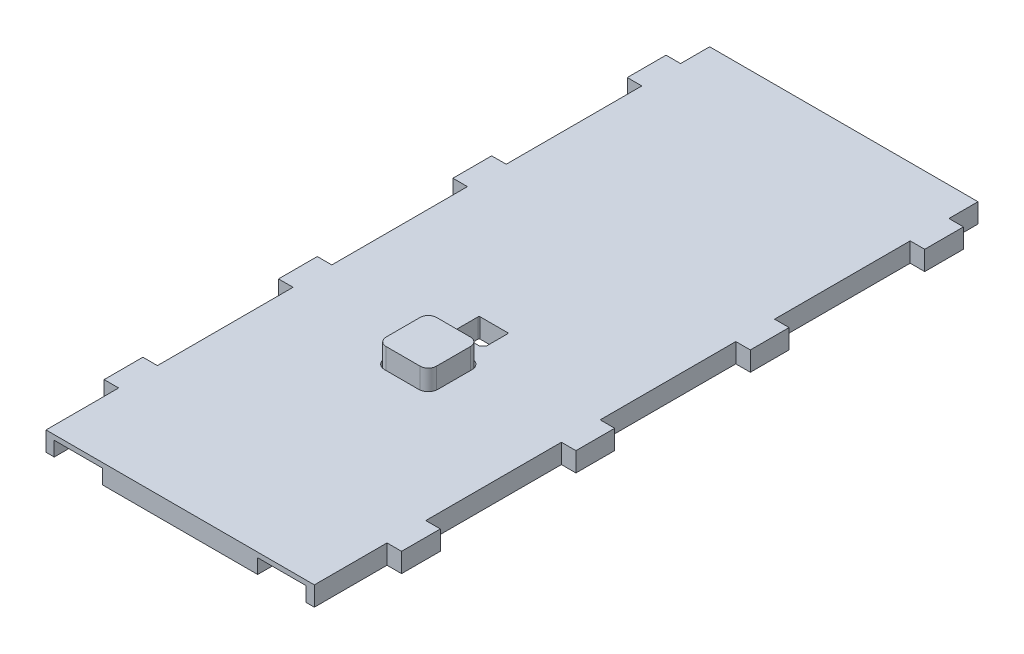
from build123d import *

# Parameters (mm, degrees)
SKETCH_1_W          = 27.7
SKETCH_1_H          = 2
EXTRUDE_1_DEPTH     = 70.5
SKETCH_16_W         = 5
SKETCH_16_H         = 1.5
CUT_EXTRUDE_6_DEPTH = 5
SKETCH_4_W          = 5.5
SKETCH_4_H          = 5.5
CUT_EXTRUDE_2_DEPTH = 72.875395651
FILLET_1_R          = 1
EXTRUDE_3_DEPTH     = 4
SKETCH_6_R          = 0.9
EXTRUDE_4_DEPTH     = 2
SKETCH_7_R          = 0.75
EXTRUDE_5_DEPTH     = 4.5
EXTRUDE_START       = 2
EXTRUDE_6_DEPTH     = 3
CUT_EXTRUDE_7_DEPTH = 2
SKETCH_18_W         = 27.7
SKETCH_18_H         = 2
CUT_EXTRUDE_8_DEPTH = 73.187758774
SKETCH_19_W         = 4
SKETCH_19_H         = 2
EXTRUDE_7_DEPTH     = 1.5
SKETCH_20_W         = 4
SKETCH_20_H         = 2
EXTRUDE_9_DEPTH     = 1.5
SKETCH_21_W         = 5
SKETCH_21_H         = 1.5
CUT_EXTRUDE_9_DEPTH = 5


with BuildPart() as part:
    # 草图1 → 凸台-拉伸1 (new body)
    with BuildSketch(Plane.XY):
        with Locations((0, 1)):
            Rectangle(SKETCH_1_W, SKETCH_1_H)
    extrude(amount=EXTRUDE_1_DEPTH)

    # 草图16 → 切除-拉伸6 (cut)
    with BuildSketch(Plane.XY.offset(70.5)):
        with Locations((-10.5, 0.75)):
            Rectangle(SKETCH_16_W, SKETCH_16_H)
        with Locations((10.5, 0.75)):
            Rectangle(SKETCH_16_W, SKETCH_16_H)
    extrude(amount=-CUT_EXTRUDE_6_DEPTH, mode=Mode.SUBTRACT)

    # 草图4 → 切除-拉伸2 (cut, through all)
    with BuildSketch(Plane(origin=(0, 2, 0), x_dir=(1, 0, 0), z_dir=(0, 1, 0))):
        with Locations((-0.000254001, -44.890957582)):
            Rectangle(SKETCH_4_W, SKETCH_4_H)
    extrude(amount=-CUT_EXTRUDE_2_DEPTH, mode=Mode.SUBTRACT)

    # 圆角1
    fillet_1_edges = [part.edges().sort_by_distance(p)[0] for p in [
        (2.749745999, 1, 42.140957582),
        (2.749745999, 1, 47.640957582),
        (-2.750254001, 1, 47.640957582),
        (-2.750254001, 1, 42.140957582),
    ]]
    fillet(fillet_1_edges, radius=FILLET_1_R)

    # 草图7 → 凸台-拉伸5 (add)
    with BuildSketch(Plane.XZ):
        with Locations(Location((4.199745999, 44.890957582, 0), (0, 0, 180))):
            Circle(SKETCH_7_R)
        with Locations(Location((-4.200254001, 44.890957582, 0), (0, 0, 180))):
            Circle(SKETCH_7_R)
    extrude(amount=EXTRUDE_5_DEPTH)

    # 草图17 → 切除-拉伸7 (cut)
    with BuildSketch(Plane(origin=(0, 2, 0), x_dir=(1, 0, 0), z_dir=(0, 1, 0))):
        with BuildLine():
            Line((1.381293223, -40.281381402), (1.381293223, -38.081000872))
            add(Edge.make_bspline(
                [(1.381293223, -38.081000872), (1.381293223, -37.981381402), (1.281673753, -37.981381402)],
                knots=[5.501585242, 5.501585242, 5.501585242, 7.064785372, 7.064785372, 7.064785372], degree=2, weights=[1, 0.709787336, 1]))
            Line((1.281673753, -37.981381402), (-1.561607713, -37.981381402))
            add(Edge.make_bspline(
                [(-1.561607713, -37.981381402), (-1.661227183, -37.981381402), (-1.661227183, -38.081000872)],
                knots=[5.501585242, 5.501585242, 5.501585242, 7.064785372, 7.064785372, 7.064785372], degree=2, weights=[1, 0.709787336, 1]))
            Line((-1.661227183, -38.081000872), (-1.661227183, -40.524282338))
            add(Edge.make_bspline(
                [(-1.661227183, -40.524282338), (-1.661227183, -40.623901808), (-1.561607713, -40.623901808)],
                knots=[5.501585242, 5.501585242, 5.501585242, 7.064785372, 7.064785372, 7.064785372], degree=2, weights=[1, 0.709787336, 1]))
            Line((-1.561607713, -40.623901808), (1.038772817, -40.623901808))
            Line((1.038772817, -40.623901808), (1.381293223, -40.281381402))
        make_face()
    extrude(amount=-CUT_EXTRUDE_7_DEPTH, mode=Mode.SUBTRACT)

    # 草图18 → 切除-拉伸8 (cut, through all)
    with BuildSketch(Plane(origin=(0, 2, 0), x_dir=(1, 0, 0), z_dir=(0, 1, 0))):
        with Locations((0, -1)):
            Rectangle(SKETCH_18_W, SKETCH_18_H)
    extrude(amount=-CUT_EXTRUDE_8_DEPTH, mode=Mode.SUBTRACT)

    # 草图19 → 凸台-拉伸7 (add)
    with BuildSketch(Plane.ZY.offset(13.85)):
        with Locations((7, 1)):
            Rectangle(SKETCH_19_W, SKETCH_19_H)
        with Locations((43, 1)):
            Rectangle(SKETCH_19_W, SKETCH_19_H)
        with Locations((25, 1)):
            Rectangle(SKETCH_19_W, SKETCH_19_H)
        with Locations((61, 1)):
            Rectangle(SKETCH_19_W, SKETCH_19_H)
    extrude(amount=EXTRUDE_7_DEPTH)

    # 草图20 → 凸台-拉伸9 (add)
    with BuildSketch(Plane(origin=(13.85, 0, 0), x_dir=(0, 0, -1), z_dir=(1, 0, 0))):
        with Locations((-61, 1)):
            Rectangle(SKETCH_20_W, SKETCH_20_H)
        with Locations((-43, 1)):
            Rectangle(SKETCH_20_W, SKETCH_20_H)
        with Locations((-25, 1)):
            Rectangle(SKETCH_20_W, SKETCH_20_H)
        with Locations((-7, 1)):
            Rectangle(SKETCH_20_W, SKETCH_20_H)
    extrude(amount=EXTRUDE_9_DEPTH)

    # 草图21 → 切除-拉伸9 (cut)
    with BuildSketch(Plane(origin=(0, 0, 2), x_dir=(-1, 0, 0), z_dir=(0, 0, -1))):
        with Locations((-10.5, 0.75)):
            Rectangle(SKETCH_21_W, SKETCH_21_H)
        with Locations((10.5, 0.75)):
            Rectangle(SKETCH_21_W, SKETCH_21_H)
    extrude(amount=-CUT_EXTRUDE_9_DEPTH, mode=Mode.SUBTRACT)


with BuildPart() as body_2:
    # 草图5 → 凸台-拉伸3 (new body)
    with BuildSketch(Plane.XZ):
        with BuildLine():
            Line((-2.600254001, 46.640957582), (-2.600254001, 43.140957582))
            ThreePointArc((-2.600254001, 43.140957582), (-2.351294765, 42.539916818), (-1.750254001, 42.290957582))
            Line((-1.750254001, 42.290957582), (1.749745999, 42.290957582))
            ThreePointArc((1.749745999, 42.290957582), (2.350786764, 42.539916818), (2.599745999, 43.140957582))
            Line((2.599745999, 43.140957582), (2.599745999, 46.640957582))
            ThreePointArc((2.599745999, 46.640957582), (2.350786764, 47.241998346), (1.749745999, 47.490957582))
            Line((1.749745999, 47.490957582), (-1.750254001, 47.490957582))
            ThreePointArc((-1.750254001, 47.490957582), (-2.351294765, 47.241998346), (-2.600254001, 46.640957582))
        make_face()
    extrude(amount=-EXTRUDE_3_DEPTH)

    # 草图6 → 凸台-拉伸4 (add)
    # profile 1 of 3: a face of its own
    with BuildSketch(Plane.XZ):
        with BuildLine():
            ThreePointArc((-2.600254001, 46.640957582), (-2.459343486, 47.109670821), (-2.08333141, 47.422980241))
            Line((-2.08333141, 47.422980241), (-4.788037664, 46.270997568))
            ThreePointArc((-4.788037664, 46.270997568), (-5.700254001, 44.890957582), (-4.788037664, 43.510917595))
            Line((-4.788037664, 43.510917595), (-2.08333141, 42.358934923))
            ThreePointArc((-2.08333141, 42.358934923), (-2.459343486, 42.672244342), (-2.600254001, 43.140957582))
            Line((-2.600254001, 43.140957582), (-2.600254001, 46.640957582))
        make_face()
        with Locations(Location((-4.200254001, 44.890957582, 0), (0, 0, 270))):
            Circle(SKETCH_6_R, mode=Mode.SUBTRACT)
    # profile 2 of 3: a face of its own
    with BuildSketch(Plane.XZ):
        with BuildLine():
            Line((1.749745999, 47.490957582), (-1.750254001, 47.490957582))
            ThreePointArc((-1.750254001, 47.490957582), (-2.351294765, 47.241998346), (-2.600254001, 46.640957582))
            Line((-2.600254001, 46.640957582), (-2.600254001, 43.140957582))
            ThreePointArc((-2.600254001, 43.140957582), (-2.351294765, 42.539916818), (-1.750254001, 42.290957582))
            Line((-1.750254001, 42.290957582), (1.749745999, 42.290957582))
            ThreePointArc((1.749745999, 42.290957582), (2.350786764, 42.539916818), (2.599745999, 43.140957582))
            Line((2.599745999, 43.140957582), (2.599745999, 46.640957582))
            ThreePointArc((2.599745999, 46.640957582), (2.350786764, 47.241998346), (1.749745999, 47.490957582))
        make_face()
    # profile 3 of 3: a face of its own
    with BuildSketch(Plane.XZ):
        with BuildLine():
            Line((4.787529663, 46.270997568), (2.082823409, 47.422980241))
            ThreePointArc((2.082823409, 47.422980241), (2.458835485, 47.109670821), (2.599745999, 46.640957582))
            Line((2.599745999, 46.640957582), (2.599745999, 43.140957582))
            ThreePointArc((2.599745999, 43.140957582), (2.458835485, 42.672244342), (2.082823409, 42.358934923))
            Line((2.082823409, 42.358934923), (4.787529663, 43.510917595))
            ThreePointArc((4.787529663, 43.510917595), (5.699745999, 44.890957582), (4.787529663, 46.270997568))
        make_face()
        with Locations(Location((4.199745999, 44.890957582, 0), (0, 0, 270))):
            Circle(SKETCH_6_R, mode=Mode.SUBTRACT)
    extrude(amount=EXTRUDE_4_DEPTH)

    # 草图6<3> → 凸台-拉伸6 (add)
    with BuildSketch(Plane.XZ.offset(EXTRUDE_START)):
        with BuildLine():
            ThreePointArc((-1.750254001, 47.490957582), (-1.920225674, 47.473789876), (-2.08333141, 47.422980241))
            ThreePointArc((-2.08333141, 47.422980241), (-2.459343486, 47.109670821), (-2.600254001, 46.640957582))
            Line((-2.600254001, 46.640957582), (-2.600254001, 43.140957582))
            ThreePointArc((-2.600254001, 43.140957582), (-2.459343486, 42.672244342), (-2.08333141, 42.358934923))
            ThreePointArc((-2.08333141, 42.358934923), (-1.920225674, 42.308125288), (-1.750254001, 42.290957582))
            Line((-1.750254001, 42.290957582), (1.749745999, 42.290957582))
            ThreePointArc((1.749745999, 42.290957582), (1.919717673, 42.308125288), (2.082823409, 42.358934923))
            ThreePointArc((2.082823409, 42.358934923), (2.458835485, 42.672244342), (2.599745999, 43.140957582))
            Line((2.599745999, 43.140957582), (2.599745999, 46.640957582))
            ThreePointArc((2.599745999, 46.640957582), (2.458835485, 47.109670821), (2.082823409, 47.422980241))
            ThreePointArc((2.082823409, 47.422980241), (1.919717673, 47.473789876), (1.749745999, 47.490957582))
            Line((1.749745999, 47.490957582), (-1.750254001, 47.490957582))
        make_face()
    extrude(amount=EXTRUDE_6_DEPTH)


solid = Compound([part.part, body_2.part])
